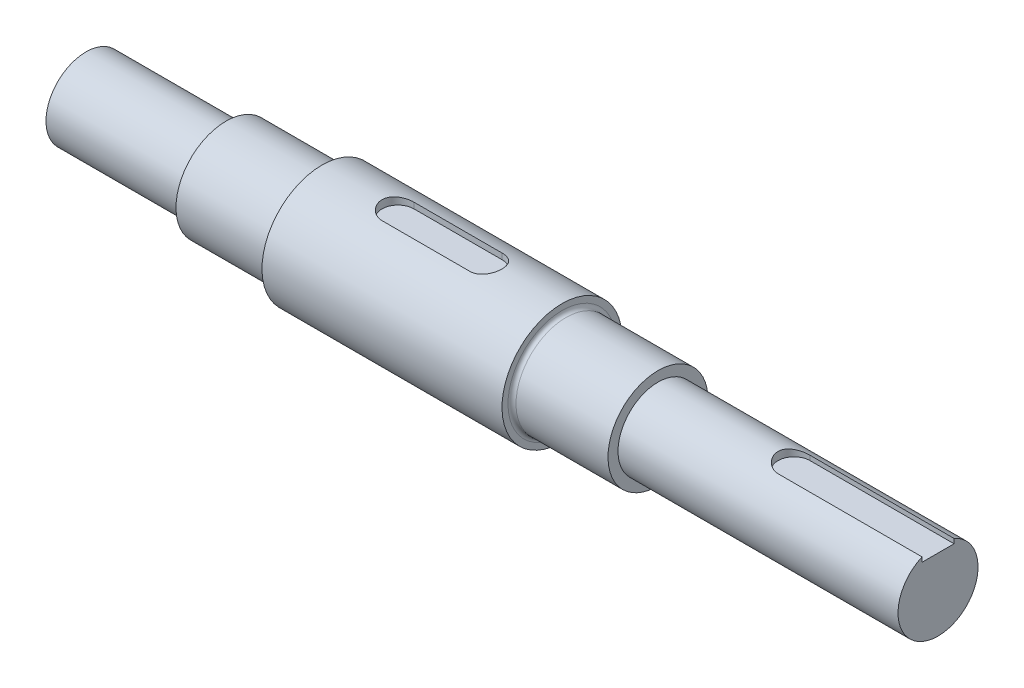
from build123d import *

# Parameters (mm, degrees)
FILLET1_R          = 1
CUT_EXTRUDE1_DEPTH = 2
CUT_EXTRUDE2_DEPTH = 2


with BuildPart() as part:
    # Sketch1 → Revolve2 (revolve)
    with BuildSketch(Plane.XY):
        Polygon((-89, 0), (-89, 10), (-54, 10), (-54, 12.5), (-30, 12.5), (-30, 15), (30, 15), (30, 12.5), (54, 12.5), (54, 10), (89, 10), (124, 10), (124, 0), align=None)
    revolve(axis=Axis((124, 0, 0), (-1, 0, 0)))

    # Fillet1
    fillet1_edges = [part.edges().sort_by_distance(p)[0] for p in [
        (30, -12.5, 0),
        (-30, -12.5, 0),
    ]]
    fillet(fillet1_edges, radius=FILLET1_R)

    # Sketch2 → Cut-Extrude1 (cut)
    with BuildSketch(Plane(origin=(0, 15, 0), x_dir=(1, 0, 0), z_dir=(0, 1, 0))):
        with BuildLine():
            Line((11, -4), (-11, -4))
            ThreePointArc((-11, -4), (-15, 0), (-11, 4))
            Line((-11, 4), (11, 4))
            ThreePointArc((11, 4), (15, 0), (11, -4))
        make_face()
    extrude(amount=-CUT_EXTRUDE1_DEPTH, mode=Mode.SUBTRACT)

    # Sketch3 → Cut-Extrude2 (cut)
    with BuildSketch(Plane(origin=(0, 10, 0), x_dir=(1, 0, 0), z_dir=(0, 1, 0))):
        with BuildLine():
            Line((124, -4), (88, -4))
            ThreePointArc((88, -4), (84, 0), (88, 4))
            Line((88, 4), (124, 4))
            Line((124, 4), (124, -4))
        make_face()
    extrude(amount=-CUT_EXTRUDE2_DEPTH, mode=Mode.SUBTRACT)


solid = part.part
